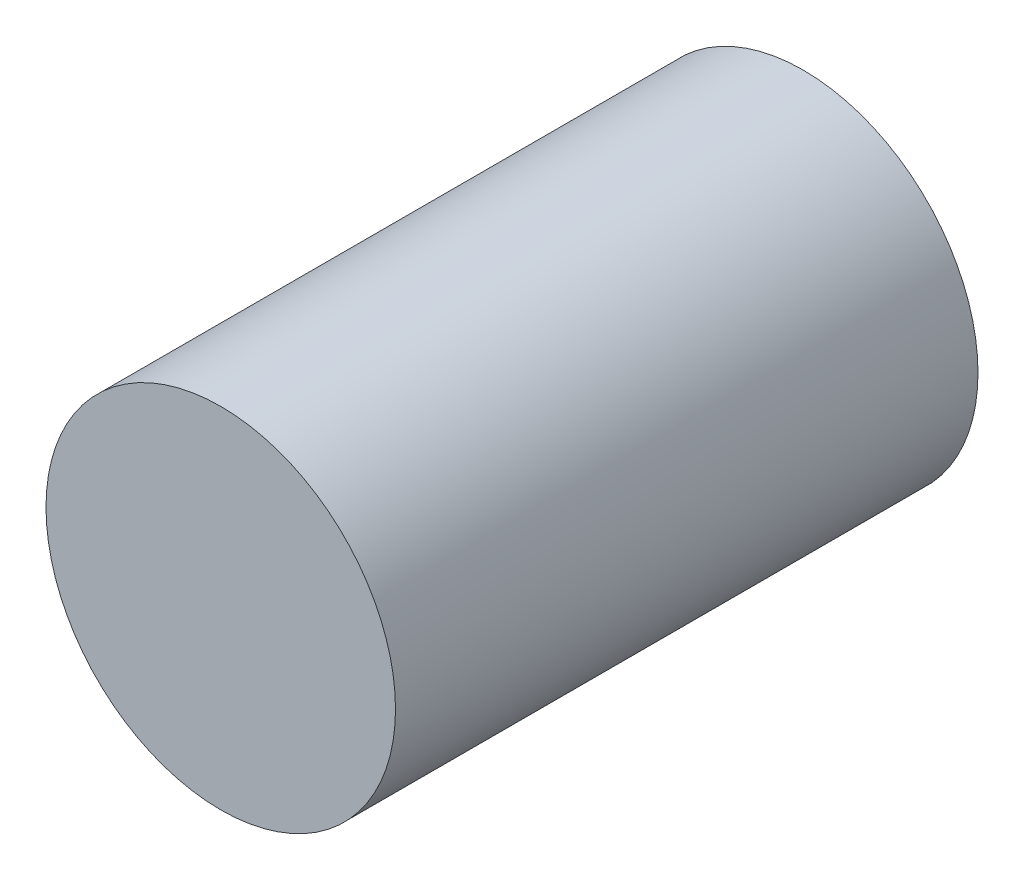
from build123d import *

# Parameters (mm, degrees)
SKETCH1_R           = 1.5
BOSS_EXTRUDE1_DEPTH = 5


with BuildPart() as part:
    # Sketch1 → Boss-Extrude1 (new body)
    with BuildSketch(Plane.XY):
        Circle(SKETCH1_R)
    extrude(amount=BOSS_EXTRUDE1_DEPTH)


solid = part.part
